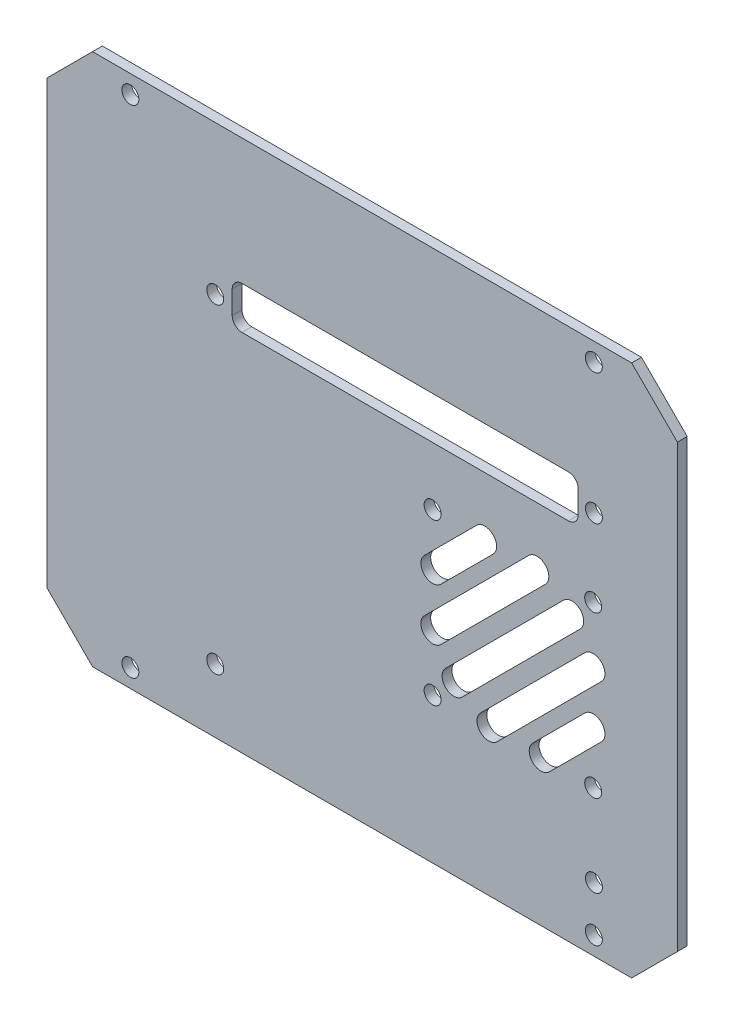
from build123d import *

# Parameters (mm, degrees)
EXTRUDE_1_DEPTH     = 1.5
SKETCH_3_R          = 1.3
CUT_EXTRUDE_1_DEPTH = 65.139634718
CUT_EXTRUDE_2_REACH = 66.14
SKETCH_4_R          = 1.3
CUT_EXTRUDE_3_REACH = 66.14
SKETCH_5_W          = 53
SKETCH_5_H          = 6.5
FILLET_1_R          = 1.5
CUT_EXTRUDE_4_REACH = 66.14
SKETCH_7_R          = 1.3
CUT_EXTRUDE_5_REACH = 66.14


with BuildPart() as part:
    # 草图2 → 凸台-拉伸1 (new body)
    with BuildSketch(Plane(origin=(0, 0, -39.19), x_dir=(-1, 0, 0), z_dir=(0, 0, -1))):
        Polygon((-47.34673203, -34.053824425), (-40.342568974, -41.057987481), (42.249104914, -41.057987481), (49.25326797, -34.053824425), (49.25326797, 33.537849463), (42.249104914, 40.542012519), (-40.342568974, 40.542012519), (-47.34673203, 33.537849463), align=None)
    extrude(amount=EXTRUDE_1_DEPTH)

    # 草图3 → 切除-拉伸1 (cut, through all)
    with BuildSketch(Plane(origin=(0, 0, -40.69), x_dir=(-1, 0, 0), z_dir=(0, 0, -1))):
        with Locations((-34.54673203, -38.257987481)):
            Circle(SKETCH_3_R)
        with Locations((36.45326797, -38.257987481)):
            Circle(SKETCH_3_R)
        with Locations((-34.54673203, 37.742012519)):
            Circle(SKETCH_3_R)
        with Locations((36.45326797, 37.742012519)):
            Circle(SKETCH_3_R)
    extrude(amount=-CUT_EXTRUDE_1_DEPTH, mode=Mode.SUBTRACT)

    # 草图4 → 切除-拉伸2 (cut, up to next)
    with BuildSketch(Plane(origin=(0, 0, -40.69), x_dir=(-1, 0, 0), z_dir=(0, 0, -1)), mode=Mode.PRIVATE) as cut_extrude_2_sk1:
        with Locations((23.45326797, -31.293200074)):
            Circle(SKETCH_4_R)
    cut_extrude_2_tool1 = extrude(cut_extrude_2_sk1.sketch, amount=-CUT_EXTRUDE_2_REACH, mode=Mode.PRIVATE) & part.part
    # 草图4 → 切除-拉伸2 (cut, up to next)
    with BuildSketch(Plane(origin=(0, 0, -40.69), x_dir=(-1, 0, 0), z_dir=(0, 0, -1)), mode=Mode.PRIVATE) as cut_extrude_2_sk2:
        with Locations((-34.558299802, -31.293200074)):
            Circle(SKETCH_4_R)
    cut_extrude_2_tool2 = extrude(cut_extrude_2_sk2.sketch, amount=-CUT_EXTRUDE_2_REACH, mode=Mode.PRIVATE) & part.part
    # 草图4 → 切除-拉伸2 (cut, up to next)
    with BuildSketch(Plane(origin=(0, 0, -40.69), x_dir=(-1, 0, 0), z_dir=(0, 0, -1)), mode=Mode.PRIVATE) as cut_extrude_2_sk3:
        with Locations((23.45326797, 17.742012519)):
            Circle(SKETCH_4_R)
    cut_extrude_2_tool3 = extrude(cut_extrude_2_sk3.sketch, amount=-CUT_EXTRUDE_2_REACH, mode=Mode.PRIVATE) & part.part
    # 草图4 → 切除-拉伸2 (cut, up to next)
    with BuildSketch(Plane(origin=(0, 0, -40.69), x_dir=(-1, 0, 0), z_dir=(0, 0, -1)), mode=Mode.PRIVATE) as cut_extrude_2_sk4:
        with Locations((-34.558299802, 17.742012519)):
            Circle(SKETCH_4_R)
    cut_extrude_2_tool4 = extrude(cut_extrude_2_sk4.sketch, amount=-CUT_EXTRUDE_2_REACH, mode=Mode.PRIVATE) & part.part
    add(cut_extrude_2_tool1.solids().sort_by_distance((-23.453268, -31.2932, -40.69))[0], mode=Mode.SUBTRACT)
    add(cut_extrude_2_tool2.solids().sort_by_distance((34.5583, -31.2932, -40.69))[0], mode=Mode.SUBTRACT)
    add(cut_extrude_2_tool3.solids().sort_by_distance((-23.453268, 17.742013, -40.69))[0], mode=Mode.SUBTRACT)
    add(cut_extrude_2_tool4.solids().sort_by_distance((34.5583, 17.742013, -40.69))[0], mode=Mode.SUBTRACT)

    # 草图5 → 切除-拉伸3 (cut, up to next)
    with BuildSketch(Plane(origin=(0, 0, -40.69), x_dir=(-1, 0, 0), z_dir=(0, 0, -1)), mode=Mode.PRIVATE) as cut_extrude_3_sk1:
        with Locations((-5.64673203, 17.992012519)):
            Rectangle(SKETCH_5_W, SKETCH_5_H)
    cut_extrude_3_tool1 = extrude(cut_extrude_3_sk1.sketch, amount=-CUT_EXTRUDE_3_REACH, mode=Mode.PRIVATE) & part.part
    add(cut_extrude_3_tool1.solids().sort_by_distance((5.646732, 17.992013, -40.69))[0], mode=Mode.SUBTRACT)

    # 圆角1
    fillet_1_edges = [part.edges().sort_by_distance(p)[0] for p in [
        (32.14673203, 14.742012519, -39.94),
        (32.14673203, 21.242012519, -39.94),
        (-20.85326797, 21.242012519, -39.94),
        (-20.85326797, 14.742012519, -39.94),
    ]]
    fillet(fillet_1_edges, radius=FILLET_1_R)

    # 草图7 → 切除-拉伸4 (cut, up to next)
    with BuildSketch(Plane(origin=(0, 0, -40.69), x_dir=(-1, 0, 0), z_dir=(0, 0, -1)), mode=Mode.PRIVATE) as cut_extrude_4_sk1:
        with Locations((-34.44673203, 5.842012519)):
            Circle(SKETCH_7_R)
    cut_extrude_4_tool1 = extrude(cut_extrude_4_sk1.sketch, amount=-CUT_EXTRUDE_4_REACH, mode=Mode.PRIVATE) & part.part
    # 草图7 → 切除-拉伸4 (cut, up to next)
    with BuildSketch(Plane(origin=(0, 0, -40.69), x_dir=(-1, 0, 0), z_dir=(0, 0, -1)), mode=Mode.PRIVATE) as cut_extrude_4_sk2:
        with Locations((-34.44673203, -18.757987481)):
            Circle(SKETCH_7_R)
    cut_extrude_4_tool2 = extrude(cut_extrude_4_sk2.sketch, amount=-CUT_EXTRUDE_4_REACH, mode=Mode.PRIVATE) & part.part
    # 草图7 → 切除-拉伸4 (cut, up to next)
    with BuildSketch(Plane(origin=(0, 0, -40.69), x_dir=(-1, 0, 0), z_dir=(0, 0, -1)), mode=Mode.PRIVATE) as cut_extrude_4_sk3:
        with Locations((-9.84673203, 5.842012519)):
            Circle(SKETCH_7_R)
    cut_extrude_4_tool3 = extrude(cut_extrude_4_sk3.sketch, amount=-CUT_EXTRUDE_4_REACH, mode=Mode.PRIVATE) & part.part
    # 草图7 → 切除-拉伸4 (cut, up to next)
    with BuildSketch(Plane(origin=(0, 0, -40.69), x_dir=(-1, 0, 0), z_dir=(0, 0, -1)), mode=Mode.PRIVATE) as cut_extrude_4_sk4:
        with Locations((-9.84673203, -18.757987481)):
            Circle(SKETCH_7_R)
    cut_extrude_4_tool4 = extrude(cut_extrude_4_sk4.sketch, amount=-CUT_EXTRUDE_4_REACH, mode=Mode.PRIVATE) & part.part
    add(cut_extrude_4_tool1.solids().sort_by_distance((34.446732, 5.842013, -40.69))[0], mode=Mode.SUBTRACT)
    add(cut_extrude_4_tool2.solids().sort_by_distance((34.446732, -18.757987, -40.69))[0], mode=Mode.SUBTRACT)
    add(cut_extrude_4_tool3.solids().sort_by_distance((9.846732, 5.842013, -40.69))[0], mode=Mode.SUBTRACT)
    add(cut_extrude_4_tool4.solids().sort_by_distance((9.846732, -18.757987, -40.69))[0], mode=Mode.SUBTRACT)

    # 草图8 → 切除-拉伸5 (cut, up to next)
    with BuildSketch(Plane(origin=(0, 0, -40.69), x_dir=(-1, 0, 0), z_dir=(0, 0, -1)), mode=Mode.PRIVATE) as cut_extrude_5_sk1:
        with BuildLine():
            Line((-29.92124863, 3.862113532), (-11.826631017, -14.232504081))
            ThreePointArc((-11.826631017, -14.232504081), (-11.826631017, -16.778088493), (-14.372215429, -16.778088493))
            Line((-14.372215429, -16.778088493), (-32.466833042, 1.31652912))
            ThreePointArc((-32.466833042, 1.31652912), (-32.466833042, 3.862113532), (-29.92124863, 3.862113532))
        make_face()
    cut_extrude_5_tool1 = extrude(cut_extrude_5_sk1.sketch, amount=-CUT_EXTRUDE_5_REACH, mode=Mode.PRIVATE) & part.part
    # 草图8 → 切除-拉伸5 (cut, up to next)
    with BuildSketch(Plane(origin=(0, 0, -40.69), x_dir=(-1, 0, 0), z_dir=(0, 0, -1)), mode=Mode.PRIVATE) as cut_extrude_5_sk2:
        with BuildLine():
            Line((-33.173939824, -1.485195275), (-17.173939824, -17.485195275))
            ThreePointArc((-17.173939824, -17.485195275), (-17.173939824, -20.030779687), (-19.719524236, -20.030779687))
            Line((-19.719524236, -20.030779687), (-35.719524236, -4.030779687))
            ThreePointArc((-35.719524236, -4.030779687), (-35.719524236, -1.485195275), (-33.173939824, -1.485195275))
        make_face()
    cut_extrude_5_tool2 = extrude(cut_extrude_5_sk2.sketch, amount=-CUT_EXTRUDE_5_REACH, mode=Mode.PRIVATE) & part.part
    # 草图8 → 切除-拉伸5 (cut, up to next)
    with BuildSketch(Plane(origin=(0, 0, -40.69), x_dir=(-1, 0, 0), z_dir=(0, 0, -1)), mode=Mode.PRIVATE) as cut_extrude_5_sk3:
        with BuildLine():
            Line((-24.573939824, 7.114804725), (-8.573939824, -8.885195275))
            ThreePointArc((-8.573939824, -8.885195275), (-8.573939824, -11.430779687), (-11.119524236, -11.430779687))
            Line((-11.119524236, -11.430779687), (-27.119524236, 4.569220313))
            ThreePointArc((-27.119524236, 4.569220313), (-27.119524236, 7.114804725), (-24.573939824, 7.114804725))
        make_face()
    cut_extrude_5_tool3 = extrude(cut_extrude_5_sk3.sketch, amount=-CUT_EXTRUDE_5_REACH, mode=Mode.PRIVATE) & part.part
    # 草图8 → 切除-拉伸5 (cut, up to next)
    with BuildSketch(Plane(origin=(0, 0, -40.69), x_dir=(-1, 0, 0), z_dir=(0, 0, -1)), mode=Mode.PRIVATE) as cut_extrude_5_sk4:
        with BuildLine():
            Line((-16.573939824, 7.114804725), (-8.573939824, -0.885195275))
            ThreePointArc((-8.573939824, -0.885195275), (-8.573939824, -3.430779687), (-11.119524236, -3.430779687))
            Line((-11.119524236, -3.430779687), (-19.119524236, 4.569220313))
            ThreePointArc((-19.119524236, 4.569220313), (-19.119524236, 7.114804725), (-16.573939824, 7.114804725))
        make_face()
    cut_extrude_5_tool4 = extrude(cut_extrude_5_sk4.sketch, amount=-CUT_EXTRUDE_5_REACH, mode=Mode.PRIVATE) & part.part
    # 草图8 → 切除-拉伸5 (cut, up to next)
    with BuildSketch(Plane(origin=(0, 0, -40.69), x_dir=(-1, 0, 0), z_dir=(0, 0, -1)), mode=Mode.PRIVATE) as cut_extrude_5_sk5:
        with BuildLine():
            Line((-33.173939824, -9.485195275), (-25.173939824, -17.485195275))
            ThreePointArc((-25.173939824, -17.485195275), (-25.173939824, -20.030779687), (-27.719524236, -20.030779687))
            Line((-27.719524236, -20.030779687), (-35.719524236, -12.030779687))
            ThreePointArc((-35.719524236, -12.030779687), (-35.719524236, -9.485195275), (-33.173939824, -9.485195275))
        make_face()
    cut_extrude_5_tool5 = extrude(cut_extrude_5_sk5.sketch, amount=-CUT_EXTRUDE_5_REACH, mode=Mode.PRIVATE) & part.part
    add(cut_extrude_5_tool1.solids().sort_by_distance((22.146732, -6.457987, -40.69))[0], mode=Mode.SUBTRACT)
    add(cut_extrude_5_tool2.solids().sort_by_distance((26.446732, -10.757987, -40.69))[0], mode=Mode.SUBTRACT)
    add(cut_extrude_5_tool3.solids().sort_by_distance((17.846732, -2.157987, -40.69))[0], mode=Mode.SUBTRACT)
    add(cut_extrude_5_tool4.solids().sort_by_distance((13.846732, 1.842013, -40.69))[0], mode=Mode.SUBTRACT)
    add(cut_extrude_5_tool5.solids().sort_by_distance((30.446732, -14.757987, -40.69))[0], mode=Mode.SUBTRACT)


solid = part.part
